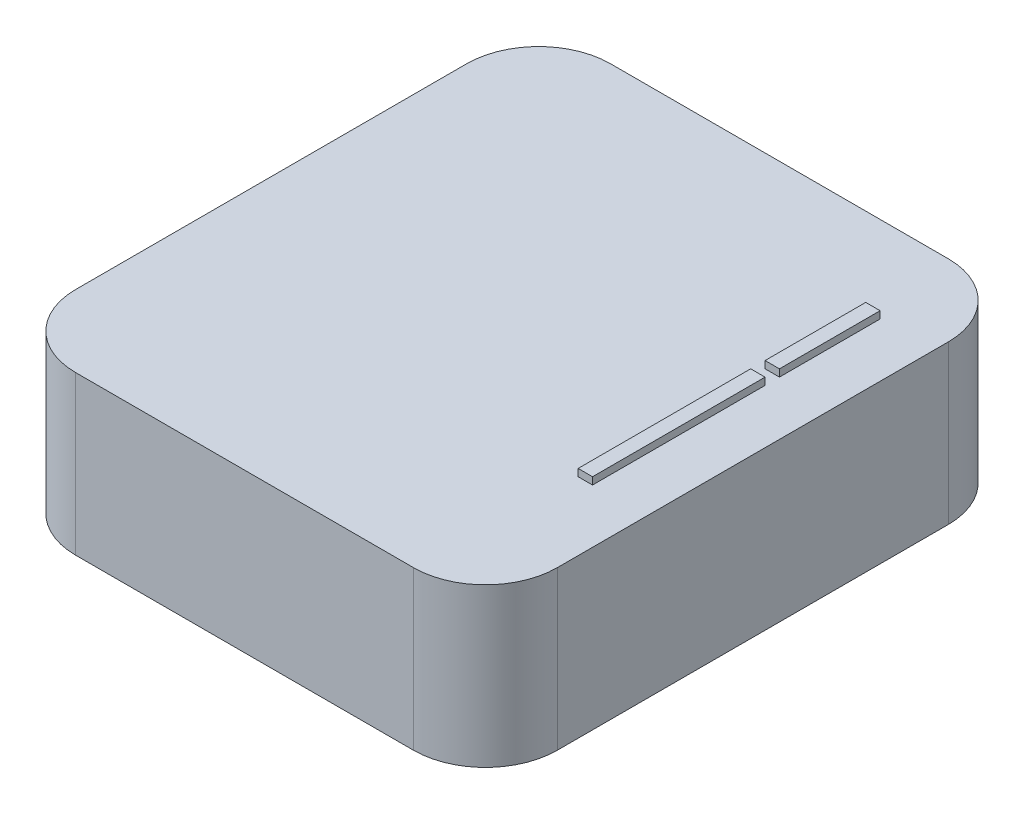
from build123d import *

# Parameters (mm, degrees)
SKETCH1_W           = 67
SKETCH1_H           = 74.4
BOSS_EXTRUDE1_DEPTH = 22
FILLET1_R           = 10
SKETCH2_W           = 15
SKETCH2_H           = 13
SKETCH2_W_2         = 10
SKETCH2_H_2         = 5
CUT_EXTRUDE1_DEPTH  = 10
SKETCH3_W           = 2
SKETCH3_H           = 14
SKETCH3_H_2         = 24
BOSS_EXTRUDE2_DEPTH = 1


with BuildPart() as part:
    # Sketch1 → Boss-Extrude1 (new body)
    with BuildSketch(Plane(origin=(0, 0, 0), x_dir=(1, 0, 0), z_dir=(0, 1, 0))):
        Rectangle(SKETCH1_W, SKETCH1_H)
    extrude(amount=BOSS_EXTRUDE1_DEPTH)

    # Fillet1
    fillet1_edges = [part.edges().sort_by_distance(p)[0] for p in [
        (33.5, 11, 37.2),
        (-33.5, 11, 37.2),
        (-33.5, 11, -37.2),
        (33.5, 11, -37.2),
    ]]
    fillet(fillet1_edges, radius=FILLET1_R)

    # Sketch2 → Cut-Extrude1 (cut)
    with BuildSketch(Plane(origin=(0, 0, -37.2), x_dir=(-1, 0, 0), z_dir=(0, 0, -1))):
        with Locations((-5, 12.5)):
            Rectangle(SKETCH2_W, SKETCH2_H)
        with Locations((10.5, 7.5)):
            Rectangle(SKETCH2_W_2, SKETCH2_H_2)
    extrude(amount=-CUT_EXTRUDE1_DEPTH, mode=Mode.SUBTRACT)

    # Sketch3 → Boss-Extrude2 (add)
    with BuildSketch(Plane(origin=(0, 22, 0), x_dir=(1, 0, 0), z_dir=(0, 1, 0))):
        with Locations((25, 18.2)):
            Rectangle(SKETCH3_W, SKETCH3_H)
        with Locations((25, -2.8)):
            Rectangle(SKETCH3_W, SKETCH3_H_2)
    extrude(amount=BOSS_EXTRUDE2_DEPTH)


solid = part.part
